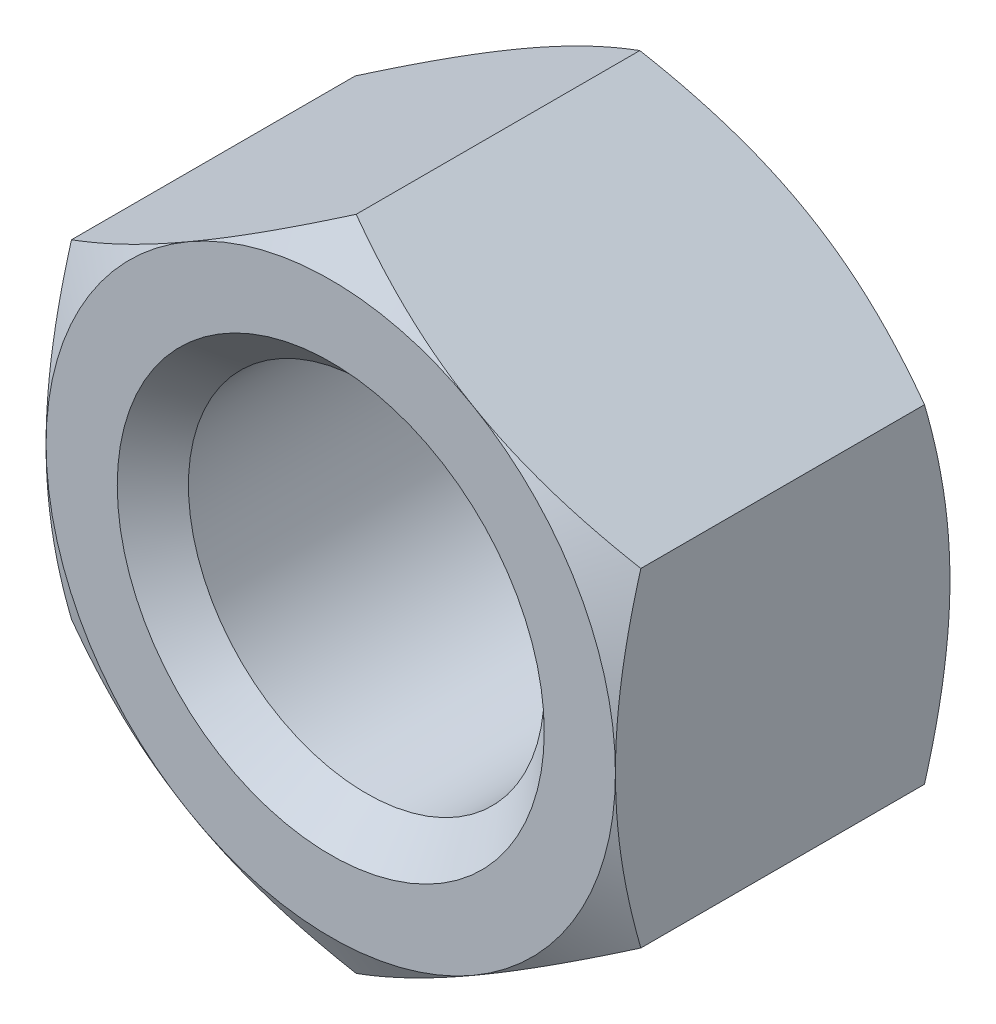
from build123d import *

# Parameters (mm, degrees)
SKETCH1_R           = 5
SKETCH1_R_2         = 2.5
BOSS_EXTRUDE1_DEPTH = 4.7
CHAMFER1_SIZE       = 1
CHAMFER1_SIZE2      = 0.577350269
CHAMFER2_SIZE       = 1
CHAMFER2_SIZE2      = 0.577350269
SKETCH1_3_R         = 5
CUT_EXTRUDE1_DEPTH  = 9.490583019
CHAMFER3_SIZE       = 0.5


with BuildPart() as part:
    # Sketch1 → Boss-Extrude1 (new body)
    with BuildSketch(Plane.XY):
        Circle(SKETCH1_R)
        Circle(SKETCH1_R_2, mode=Mode.SUBTRACT)
    extrude(amount=BOSS_EXTRUDE1_DEPTH)

    # Chamfer1
    chamfer1_edges = [part.edges().sort_by_distance(p)[0] for p in [
        (-5, 0, 4.7),
    ]]
    chamfer1_side = [part.faces().sort_by_distance(p)[0] for p in [
        (-4.858578644, 0, 4.7),
    ]]
    chamfer(chamfer1_edges, length=CHAMFER1_SIZE, length2=CHAMFER1_SIZE2, reference=chamfer1_side[0])

    # Chamfer2
    chamfer2_edges = [part.edges().sort_by_distance(p)[0] for p in [
        (-5, 0, 0),
    ]]
    chamfer2_side = [part.faces().sort_by_distance(p)[0] for p in [
        (-4.858578644, 0, 0),
    ]]
    chamfer(chamfer2_edges, length=CHAMFER2_SIZE, length2=CHAMFER2_SIZE2, reference=chamfer2_side[0])

    # Sketch1<3> → Cut-Extrude1 (cut, through all)
    with BuildSketch(Plane.XY):
        Circle(SKETCH1_3_R)
        Polygon((-4, 2.309401077), (0, 4.618802154), (4, 2.309401077), (4, -2.309401077), (0, -4.618802154), (-4, -2.309401077), align=None, mode=Mode.SUBTRACT)
    extrude(amount=CUT_EXTRUDE1_DEPTH, mode=Mode.SUBTRACT)

    # Chamfer3
    chamfer3_edges = [part.edges().sort_by_distance(p)[0] for p in [
        (-2.5, 0, 0),
        (-2.5, 0, 4.7),
    ]]
    chamfer(chamfer3_edges, length=CHAMFER3_SIZE)


solid = part.part
